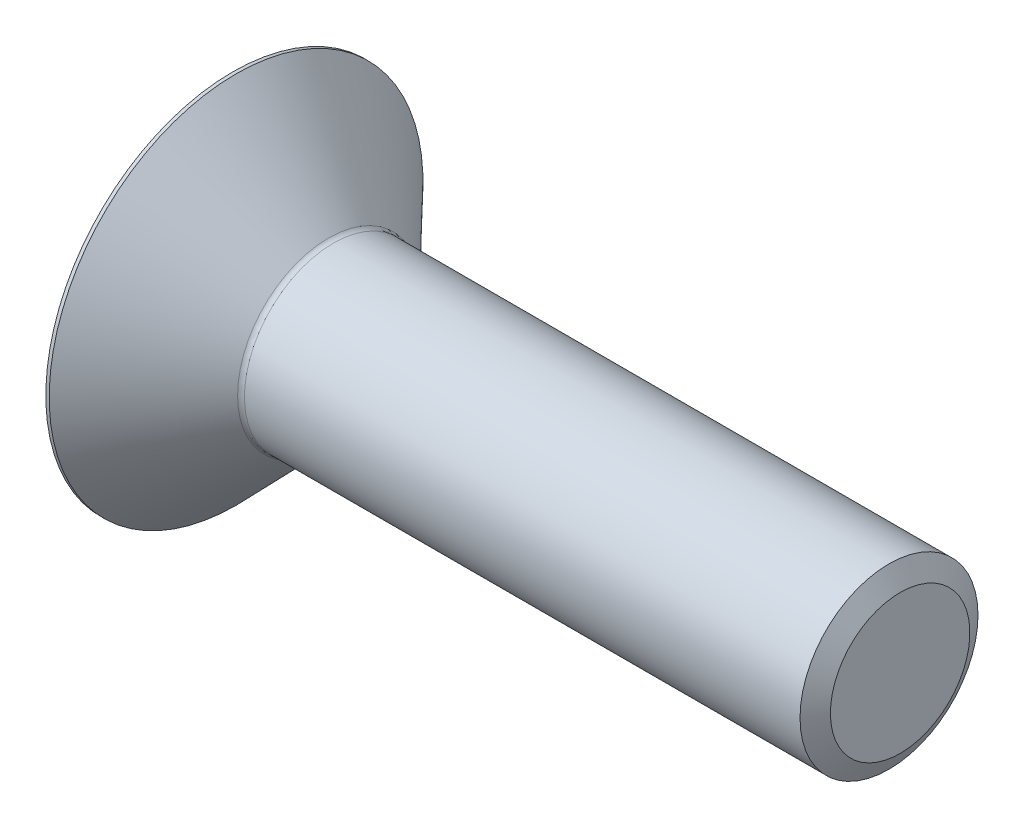
from build123d import *

# Parameters (mm, degrees)
CUT_EXTRUDE_1_DEPTH = 8.8


with BuildPart() as part:
    # 草图1 → 旋转1 (revolve)
    with BuildSketch(Plane.XY):
        with BuildLine():
            Line((0, 8), (-50.94531511, 8))
            ThreePointArc((-50.94531511, 8), (-51.179753787, 8.047697088), (-51.37691899, 8.183204978))
            Line((-51.37691899, 8.183204978), (-59.698061218, 16.8))
            Line((-59.698061218, 16.8), (-60, 16.8))
            Line((-60, 16.8), (-60, 0))
            Line((-60, 0), (0, 0))
            Line((0, 0), (0, 8))
        make_face()
    revolve(axis=Axis((0, 0, 0), (-1, 0, 0)))

    # 草图2 → 切除-拉伸1 (cut)
    with BuildSketch(Plane.ZY.offset(60)):
        Polygon((0, 5.773502692), (-5, 2.886751346), (-5, -2.886751346), (0, -5.773502692), (5, -2.886751346), (5, 2.886751346), align=None)
    extrude(amount=-CUT_EXTRUDE_1_DEPTH, mode=Mode.SUBTRACT)

    # 草图6 → 旋转2 (revolve)
    with BuildSketch(Plane.XY):
        Polygon((-55.2, 5.773502692), (-51.866666667, 0), (-49.77, 0), (-49.77, 5.773502692), align=None)
    revolve(axis=Axis((-60, 0, 0), (1, 0, 0)))

    # 草图7 → 切除-旋转2 (revolve, cut)
    with BuildSketch(Plane.XY):
        Polygon((-60, 5.773502692), (-60, 0), (-58.57, 0), align=None)
    revolve(axis=Axis((-60, 0, 0), (1, 0, 0)), mode=Mode.SUBTRACT)

    # 草图4 → 切除-旋转1 (revolve, cut)
    with BuildSketch(Plane.XY):
        Polygon((-1, 8), (0, 6.267949192), (1, 8), align=None)
    revolve(axis=Axis((-1, 0, 0), (1, 0, 0)), mode=Mode.SUBTRACT)


solid = part.part
